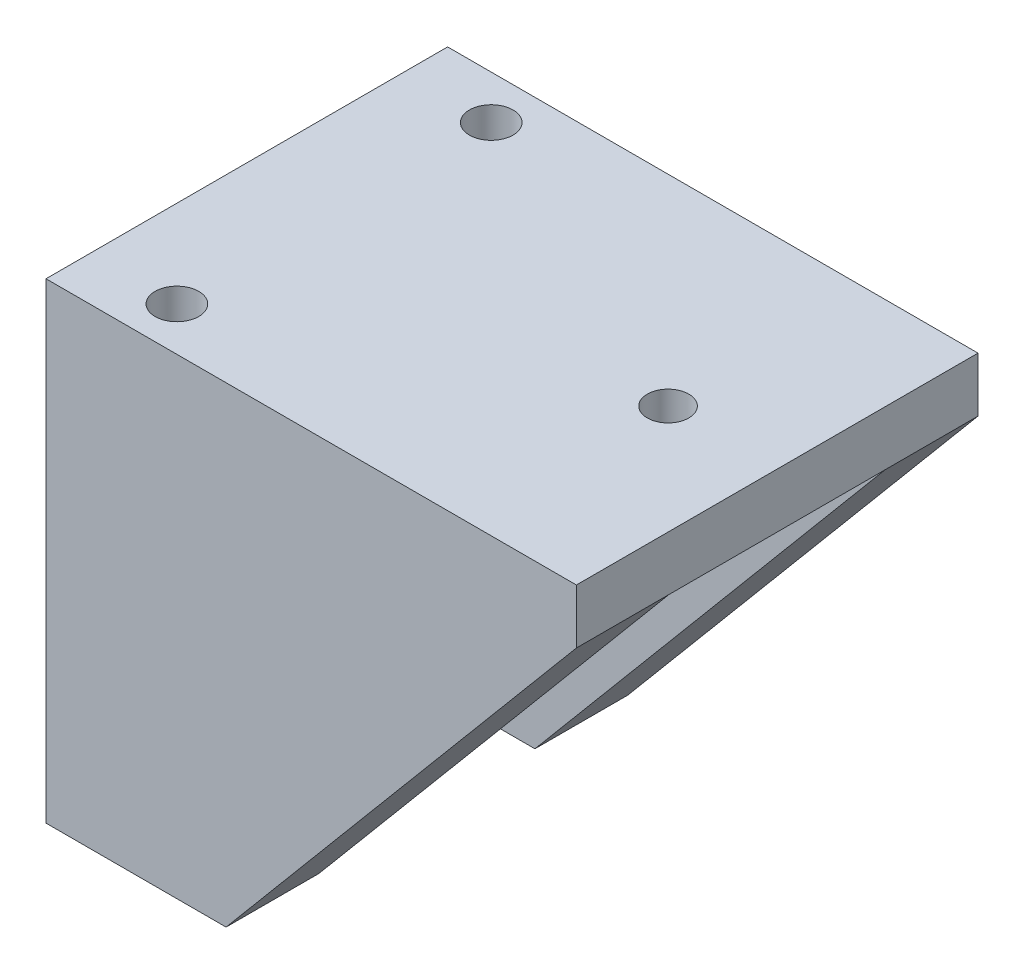
from build123d import *

# Parameters (mm, degrees)
EXTRUDE_1_DEPTH     = 19.8
EXTRUDE_1_2_DEPTH   = 19.8
SKETCH_2_W          = 1
SKETCH_2_H          = 0.8
CUT_EXTRUDE_1_DEPTH = 8
EXTRUDE_2_DEPTH     = 8.5
EXTRUDE_3_DEPTH     = 8.5
CUT_EXTRUDE_2_REACH = 72.966
SKETCH_5_R          = 1.9
CUT_EXTRUDE_5_REACH = 68.083
SKETCH_8_W          = 19.8
SKETCH_8_H          = 8.5
SKETCH_9_R          = 1.65
EXTRUDE_4_DEPTH     = 11.3
CUT_EXTRUDE_6_REACH = 72.966
SKETCH_10_R         = 2


with BuildPart() as part:
    # 草圖1 → 填料-伸長1 (new body)
    with BuildSketch(Plane.XY):
        Polygon((-40.673096552, 29.7), (-40.673096552, 2.8), (-48.673096552, 2.8), (-48.673096552, 34.7), (-41.673096552, 34.7), (-0.073096552, 34.7), (-0.073096552, 29.7), align=None)
    extrude(amount=EXTRUDE_1_DEPTH)



with BuildPart() as body_2:
    # 草圖1 → Extrude 1 2 (new body)
    with BuildSketch(Plane.XY):
        Polygon((-48.673096552, -8.5), (-40.673096552, -8.5), (-40.673096552, -3.2), (-40.673096552, 0), (-48.673096552, 0), align=None)
    extrude(amount=EXTRUDE_1_2_DEPTH)

    # 草圖2 → 除料-伸長1 (cut)
    with BuildSketch(Plane.ZY.offset(48.673096552)):
        with Locations((9.9, -0.4)):
            Rectangle(SKETCH_2_W, SKETCH_2_H)
    extrude(amount=-CUT_EXTRUDE_1_DEPTH, mode=Mode.SUBTRACT)


with BuildPart() as part_1:
    add(part.part)

    add(body_2.part)  # 填料-伸長2 merges body 2
    # 草圖3 → 填料-伸長2 (add)
    with BuildSketch(Plane.XY.offset(19.8)):
        Polygon((-48.673096552, -8.5), (-32.173096552, -8.5), (-0.073096552, 29.7), (-0.073096552, 34.7), (-48.673096552, 34.7), align=None)
    extrude(amount=EXTRUDE_2_DEPTH)

    # 草圖4 → 填料-伸長3 (add)
    with BuildSketch(Plane(origin=(0, 0, 0), x_dir=(-1, 0, 0), z_dir=(0, 0, -1))):
        Polygon((48.673096552, -8.5), (48.673096552, 34.7), (0.073096552, 34.7), (0.073096552, 29.7), (32.173096552, -8.5), align=None)
    extrude(amount=EXTRUDE_3_DEPTH)

    # 草圖5 → 除料-伸長2 (cut, up to next)
    with BuildSketch(Plane(origin=(0, 34.7, 0), x_dir=(1, 0, 0), z_dir=(0, 1, 0)), mode=Mode.PRIVATE) as cut_extrude_2_sk1:
        with Locations(Location((-10.073096552, -9.9, 0), (0, 0, 270))):
            Circle(SKETCH_5_R)
    cut_extrude_2_tool1 = extrude(cut_extrude_2_sk1.sketch, amount=-CUT_EXTRUDE_2_REACH, mode=Mode.PRIVATE) & part_1.part
    add(cut_extrude_2_tool1.solids().sort_by_distance((-10.073097, 34.7, 9.9))[0], mode=Mode.SUBTRACT)

    # 除料-伸長5: up to this plane
    cut_extrude_5_end = Plane(origin=(-0.073096552, 29.7, -8.5), z_dir=(-0.7655864074982082, 0.6433330806464003, 0))
    # 草圖8 → 除料-伸長5 (cut, up to the surface)
    with BuildSketch(Plane.ZY.offset(48.673096552), mode=Mode.PRIVATE) as cut_extrude_5_sk1:
        with Locations((9.9, -4.25)):
            Rectangle(SKETCH_8_W, SKETCH_8_H)
    cut_extrude_5_tool1 = split(extrude(cut_extrude_5_sk1.sketch, amount=-CUT_EXTRUDE_5_REACH, mode=Mode.PRIVATE), bisect_by=cut_extrude_5_end, keep=Keep.BOTH, mode=Mode.PRIVATE)
    add(cut_extrude_5_tool1.solids().sort_by_distance((-48.673097, -4.25, 9.9))[0], mode=Mode.SUBTRACT)

    # 草圖9 → 填料-伸長4 (add)
    with BuildSketch(Plane.XZ.offset(-2.8)):
        with Locations(Location((-45.273096552, 14.9, 0), (0, 0, 90))):
            Circle(SKETCH_9_R)
        with Locations(Location((-45.273096552, 4.9, 0), (0, 0, 90))):
            Circle(SKETCH_9_R)
    extrude(amount=EXTRUDE_4_DEPTH)

    # 草圖10 → 除料-伸長6 (cut, up to next)
    with BuildSketch(Plane(origin=(0, -8.5, 0), x_dir=(-1, 0, 0), z_dir=(0, -1, 0)), mode=Mode.PRIVATE) as cut_extrude_6_sk1:
        with Locations(Location((40.677003756, -24.3, 0), (0, 0, 90))):
            Circle(SKETCH_10_R)
    cut_extrude_6_tool1 = extrude(cut_extrude_6_sk1.sketch, amount=-CUT_EXTRUDE_6_REACH, mode=Mode.PRIVATE) & part_1.part
    # 草圖10 → 除料-伸長6 (cut, up to next)
    with BuildSketch(Plane(origin=(0, -8.5, 0), x_dir=(-1, 0, 0), z_dir=(0, -1, 0)), mode=Mode.PRIVATE) as cut_extrude_6_sk2:
        with Locations(Location((40.673096552, 4.495764624, 0), (0, 0, 90))):
            Circle(SKETCH_10_R)
    cut_extrude_6_tool2 = extrude(cut_extrude_6_sk2.sketch, amount=-CUT_EXTRUDE_6_REACH, mode=Mode.PRIVATE) & part_1.part
    add(cut_extrude_6_tool1.solids().sort_by_distance((-40.677004, -8.5, 24.3))[0], mode=Mode.SUBTRACT)
    add(cut_extrude_6_tool2.solids().sort_by_distance((-40.673097, -8.5, -4.495765))[0], mode=Mode.SUBTRACT)


solid = part_1.part
